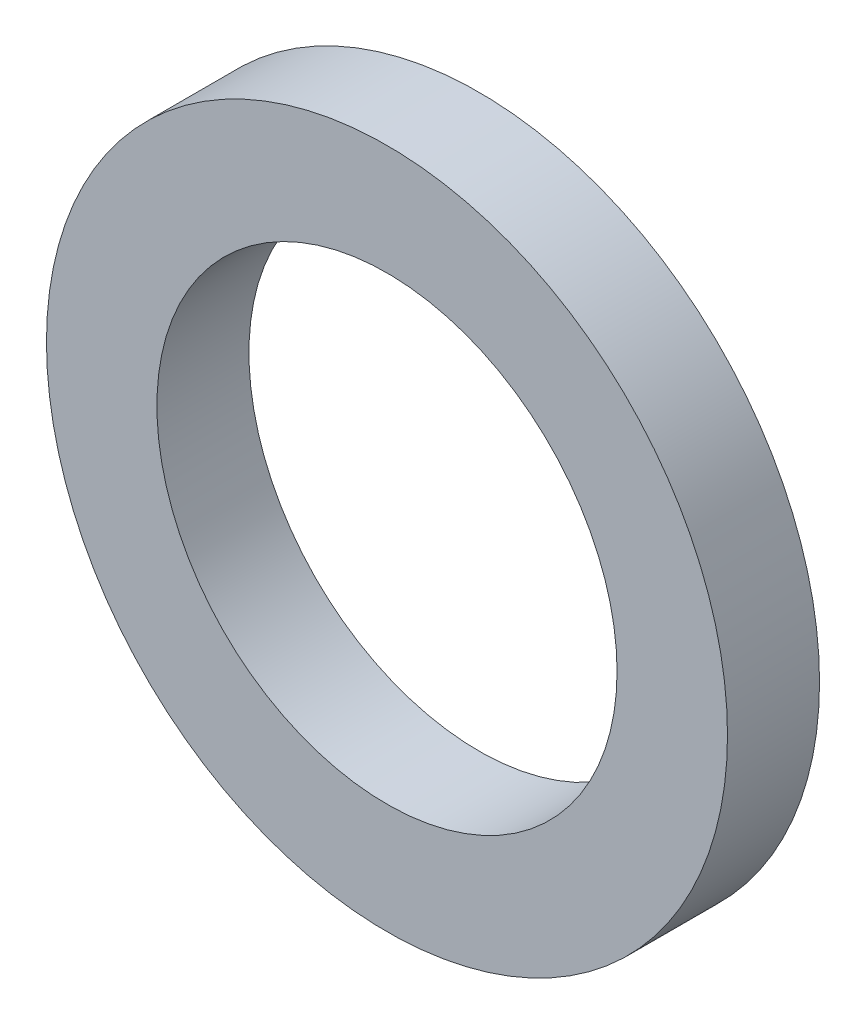
from build123d import *

# Parameters (mm, degrees)
SKETCH_1_R      = 18.5
SKETCH_1_R_2    = 12.5
EXTRUDE_1_DEPTH = 5


with BuildPart() as part:
    # Эскиз1 → Бобышка-Вытянуть1 (new body)
    with BuildSketch(Plane.XY):
        Circle(SKETCH_1_R)
        Circle(SKETCH_1_R_2, mode=Mode.SUBTRACT)
    extrude(amount=EXTRUDE_1_DEPTH)


solid = part.part
